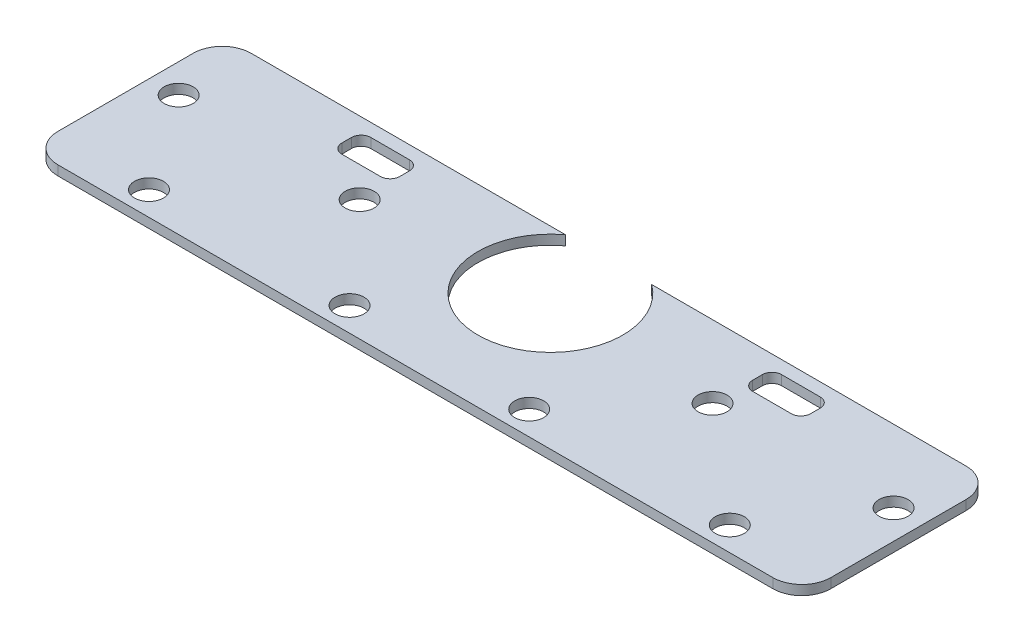
from build123d import *

# Parameters (mm, degrees)
SKETCH1_R           = 15
BOSS_EXTRUDE1_DEPTH = 10


with BuildPart() as part:
    # Sketch1 → Boss-Extrude1 (new body)
    with BuildSketch(Plane(origin=(0, 0, 0), x_dir=(1, 0, 0), z_dir=(0, 1, 0))):
        with BuildLine():
            Line((-370, -100), (370, -100))
            ThreePointArc((370, -100), (391.213203436, -91.213203436), (400, -70))
            Line((400, -70), (400, 70))
            ThreePointArc((400, 70), (391.213203436, 91.213203436), (370, 100))
            Line((370, 100), (44.619962618, 100))
            ThreePointArc((44.619962618, 100), (66.975731412, 73.469642109), (75, 39.716843679))
            ThreePointArc((75, 39.716843679), (-33.75279843, -27.258887733), (-44.619962618, 100))
            Line((-44.619962618, 100), (-370, 100))
            ThreePointArc((-370, 100), (-391.213203436, 91.213203436), (-400, 70))
            Line((-400, 70), (-400, -70))
            ThreePointArc((-400, -70), (-391.213203436, -91.213203436), (-370, -100))
        make_face()
        with Locations(Location((-300.6181604, -75.1545401, 0), (0, 0, 270))):
            Circle(SKETCH1_R, mode=Mode.SUBTRACT)
        with Locations(Location((-92.979550381, -75.1545401, 0), (0, 0, 270))):
            Circle(SKETCH1_R, mode=Mode.SUBTRACT)
        with Locations(Location((92.979550381, -75.1545401, 0), (0, 0, 270))):
            Circle(SKETCH1_R, mode=Mode.SUBTRACT)
        with Locations(Location((300.6181604, -75.1545401, 0), (0, 0, 270))):
            Circle(SKETCH1_R, mode=Mode.SUBTRACT)
        with Locations(Location((-370, 24.949199623, 0), (0, 0, 270))):
            Circle(SKETCH1_R, mode=Mode.SUBTRACT)
        with Locations(Location((-182.623487934, 24.949199623, 0), (0, 0, 270))):
            Circle(SKETCH1_R, mode=Mode.SUBTRACT)
        with BuildLine():
            ThreePointArc((-242.623487934, 76.468107678), (-239.694555745, 83.53917549), (-232.623487934, 86.468107678))
            Line((-232.623487934, 86.468107678), (-192.623487934, 86.468107678))
            ThreePointArc((-192.623487934, 86.468107678), (-185.552420122, 83.53917549), (-182.623487934, 76.468107678))
            Line((-182.623487934, 76.468107678), (-182.623487934, 66.468107678))
            ThreePointArc((-182.623487934, 66.468107678), (-185.552420122, 59.397039866), (-192.623487934, 56.468107678))
            Line((-192.623487934, 56.468107678), (-232.623487934, 56.468107678))
            ThreePointArc((-232.623487934, 56.468107678), (-239.694555745, 59.397039866), (-242.623487934, 66.468107678))
            Line((-242.623487934, 66.468107678), (-242.623487934, 76.468107678))
        make_face(mode=Mode.SUBTRACT)
        with Locations(Location((182.623487934, 24.949199623, 0), (0, 0, 270))):
            Circle(SKETCH1_R, mode=Mode.SUBTRACT)
        with Locations(Location((370, 24.949199623, 0), (0, 0, 270))):
            Circle(SKETCH1_R, mode=Mode.SUBTRACT)
        with BuildLine():
            ThreePointArc((242.623487934, 66.468107678), (239.694555745, 59.397039866), (232.623487934, 56.468107678))
            Line((232.623487934, 56.468107678), (192.623487934, 56.468107678))
            ThreePointArc((192.623487934, 56.468107678), (185.552420122, 59.397039866), (182.623487934, 66.468107678))
            Line((182.623487934, 66.468107678), (182.623487934, 76.468107678))
            ThreePointArc((182.623487934, 76.468107678), (185.552420122, 83.53917549), (192.623487934, 86.468107678))
            Line((192.623487934, 86.468107678), (232.623487934, 86.468107678))
            ThreePointArc((232.623487934, 86.468107678), (239.694555745, 83.53917549), (242.623487934, 76.468107678))
            Line((242.623487934, 76.468107678), (242.623487934, 66.468107678))
        make_face(mode=Mode.SUBTRACT)
    extrude(amount=BOSS_EXTRUDE1_DEPTH)


solid = part.part
